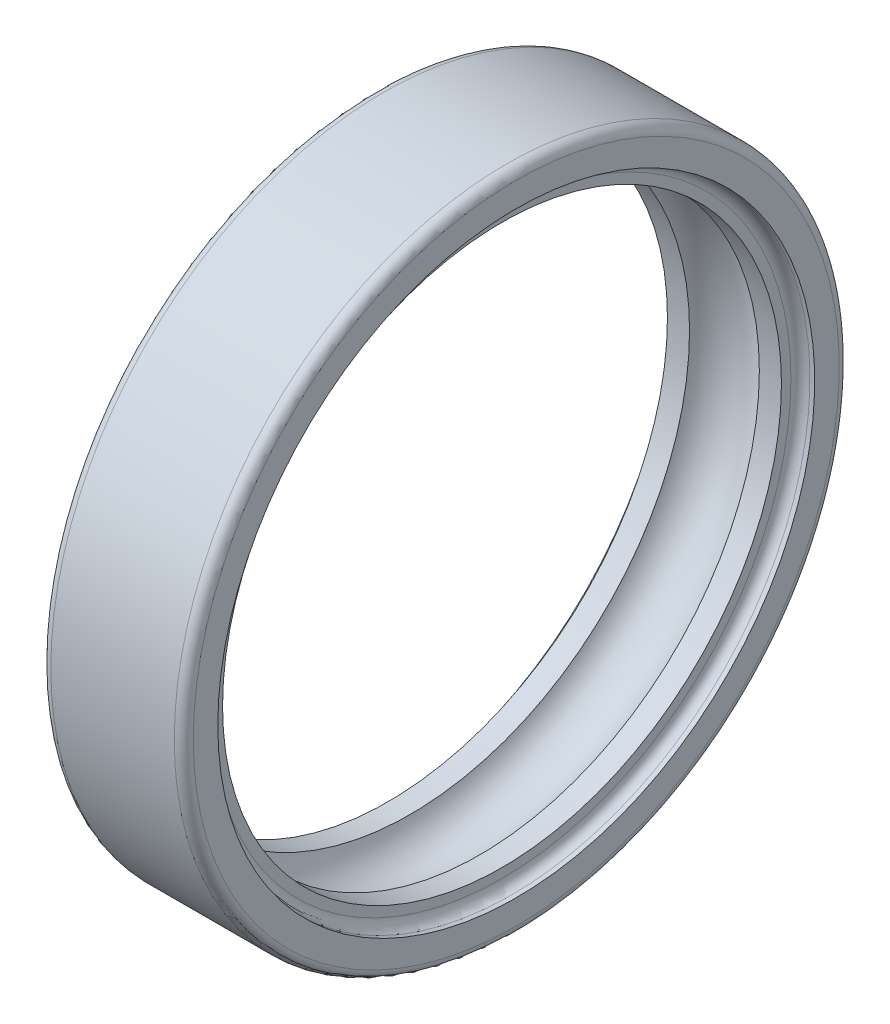
from build123d import *


with BuildPart() as part:
    # Sketch1 → Revolve1 (revolve)
    with BuildSketch(Plane.XY, mode=Mode.PRIVATE) as revolve1_sk:
        with BuildLine():
            Line((0, 20.4), (0, 18.85))
            Line((0, 18.85), (0.3, 18.85))
            ThreePointArc((0.3, 18.85), (0.724264069, 18.674264069), (0.9, 18.25))
            Line((0.9, 18.25), (0.9, 17.65))
            Line((0.9, 17.65), (2.295649529, 17.65))
            ThreePointArc((2.295649529, 17.65), (4.5, 19.131), (6.704350471, 17.65))
            Line((6.704350471, 17.65), (8.1, 17.65))
            Line((8.1, 17.65), (8.1, 18.25))
            ThreePointArc((8.1, 18.25), (8.275735931, 18.674264069), (8.7, 18.85))
            Line((8.7, 18.85), (9, 18.85))
            Line((9, 18.85), (9, 20.4))
            ThreePointArc((9, 20.4), (8.824264069, 20.824264069), (8.4, 21))
            Line((8.4, 21), (0.6, 21))
            ThreePointArc((0.6, 21), (0.175735931, 20.824264069), (0, 20.4))
        make_face()
    revolve(revolve1_sk.sketch.rotate(Axis((50, 0, 0), (-1, 0, 0)), 270), axis=Axis((50, 0, 0), (-1, 0, 0)))

    # Sketch2 → Revolve2 (revolve)
    with BuildSketch(Plane.XY, mode=Mode.PRIVATE) as revolve2_sk:
        with BuildLine():
            Line((0, 20.4), (0, 18.85))
            Line((0, 18.85), (0.3, 18.85))
            ThreePointArc((0.3, 18.85), (0.724264069, 18.674264069), (0.9, 18.25))
            Line((0.9, 18.25), (0.9, 17.65))
            Line((0.9, 17.65), (2.295649529, 17.65))
            ThreePointArc((2.295649529, 17.65), (4.5, 19.131), (6.704350471, 17.65))
            Line((6.704350471, 17.65), (8.1, 17.65))
            Line((8.1, 17.65), (8.1, 18.25))
            ThreePointArc((8.1, 18.25), (8.275735931, 18.674264069), (8.7, 18.85))
            Line((8.7, 18.85), (9, 18.85))
            Line((9, 18.85), (9, 20.4))
            ThreePointArc((9, 20.4), (8.824264069, 20.824264069), (8.4, 21))
            Line((8.4, 21), (0.6, 21))
            ThreePointArc((0.6, 21), (0.175735931, 20.824264069), (0, 20.4))
        make_face()
    revolve(revolve2_sk.sketch.rotate(Axis((50, 0, 0), (-1, 0, 0)), 270), axis=Axis((50, 0, 0), (-1, 0, 0)))


solid = part.part
